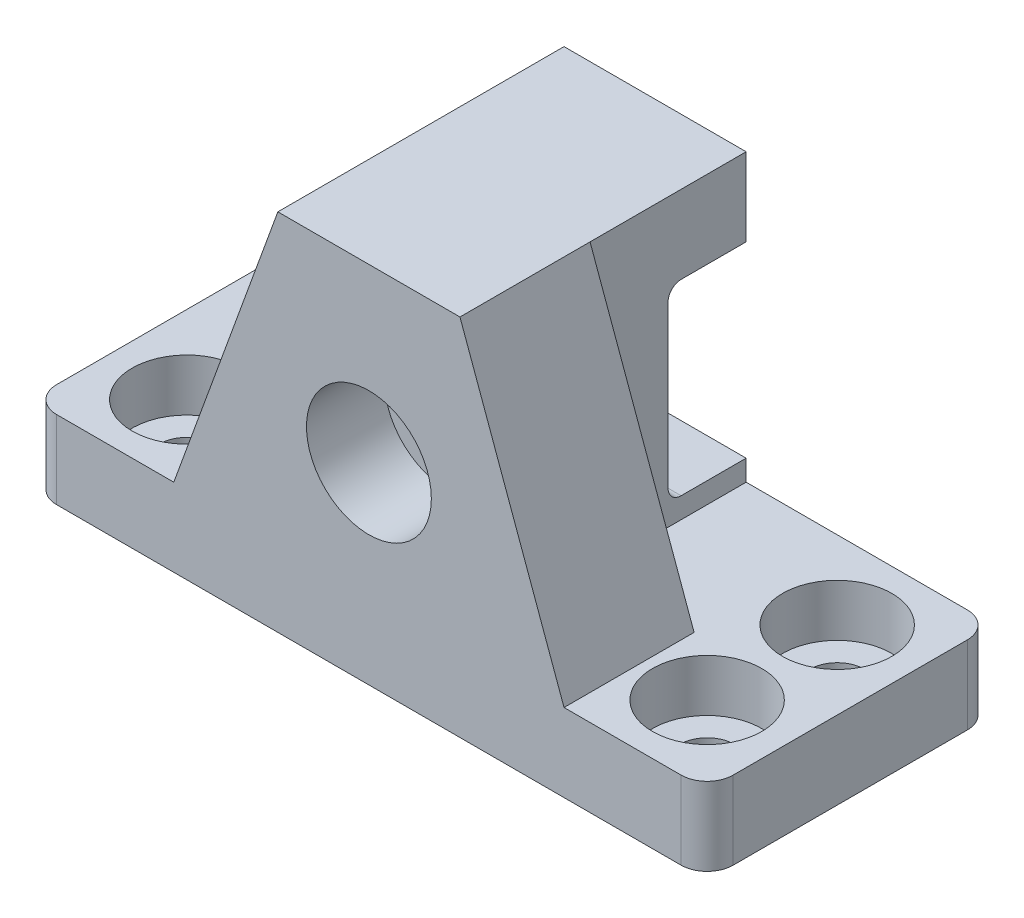
from build123d import *

# Parameters (mm, degrees)
SKETCH1_W           = 26
SKETCH1_H           = 11
SKETCH1_R           = 1.05
BOSS_EXTRUDE1_DEPTH = 3
SKETCH10_R          = 2.1
CUT_EXTRUDE6_DEPTH  = 2
SKETCH3_W           = 7
SKETCH3_H           = 14
BOSS_EXTRUDE2_DEPTH = 11
SKETCH6_W           = 3
SKETCH6_H           = 7.2
CUT_EXTRUDE3_DEPTH  = 23.327113562
SKETCH7_R           = 1.35
CUT_EXTRUDE4_DEPTH  = 21.712315177
SKETCH8_R           = 2.4
CUT_EXTRUDE5_DEPTH  = 3
FILLET1_R           = 0.5
FILLET2_R           = 1
BOSS_EXTRUDE3_DEPTH = 5


with BuildPart() as part:
    # Sketch1 → Boss-Extrude1 (new body)
    with BuildSketch(Plane(origin=(0, 0, 0), x_dir=(1, 0, 0), z_dir=(0, 1, 0))):
        Rectangle(SKETCH1_W, SKETCH1_H)
        with Locations(Location((-10, 2.5, 0), (0, 0, 270))):
            Circle(SKETCH1_R, mode=Mode.SUBTRACT)
        with Locations(Location((-10, -2.5, 0), (0, 0, 270))):
            Circle(SKETCH1_R, mode=Mode.SUBTRACT)
        with Locations(Location((10, 2.5, 0), (0, 0, 270))):
            Circle(SKETCH1_R, mode=Mode.SUBTRACT)
        with Locations(Location((10, -2.5, 0), (0, 0, 270))):
            Circle(SKETCH1_R, mode=Mode.SUBTRACT)
    extrude(amount=BOSS_EXTRUDE1_DEPTH)

    # Sketch10 → Cut-Extrude6 (cut)
    with BuildSketch(Plane(origin=(0, 3, 0), x_dir=(1, 0, 0), z_dir=(0, 1, 0))):
        with Locations(Location((-10, 2.5, 0), (0, 0, 270))):
            Circle(SKETCH10_R)
        with Locations(Location((-10, -2.5, 0), (0, 0, 270))):
            Circle(SKETCH10_R)
        with Locations(Location((10, 2.5, 0), (0, 0, 270))):
            Circle(SKETCH10_R)
        with Locations(Location((10, -2.5, 0), (0, 0, 270))):
            Circle(SKETCH10_R)
    extrude(amount=-CUT_EXTRUDE6_DEPTH, mode=Mode.SUBTRACT)

    # Sketch3 → Boss-Extrude2 (add)
    with BuildSketch(Plane(origin=(0, 0, -5.5), x_dir=(-1, 0, 0), z_dir=(0, 0, -1))):
        with Locations((0, 7)):
            Rectangle(SKETCH3_W, SKETCH3_H)
    extrude(amount=-BOSS_EXTRUDE2_DEPTH)

    # Sketch6 → Cut-Extrude3 (cut, through all)
    with BuildSketch(Plane(origin=(3.5, 0, 0), x_dir=(0, 0, -1), z_dir=(1, 0, 0))):
        with Locations((4, 7.4)):
            Rectangle(SKETCH6_W, SKETCH6_H)
    extrude(amount=-CUT_EXTRUDE3_DEPTH, mode=Mode.SUBTRACT)

    # Sketch7 → Cut-Extrude4 (cut, through all)
    with BuildSketch(Plane(origin=(0, 0, -2.5), x_dir=(-1, 0, 0), z_dir=(0, 0, -1))):
        with Locations(Location((0, 7.4, 0), (0, 0, 90))):
            Circle(SKETCH7_R)
    extrude(amount=-CUT_EXTRUDE4_DEPTH, mode=Mode.SUBTRACT)

    # Sketch8 → Cut-Extrude5 (cut)
    with BuildSketch(Plane.XY.offset(5.5)):
        with Locations((0, 7.4)):
            Circle(SKETCH8_R)
    extrude(amount=-CUT_EXTRUDE5_DEPTH, mode=Mode.SUBTRACT)

    # Fillet1
    fillet1_edges = [part.edges().sort_by_distance(p)[0] for p in [
        (0, 3.8, -2.5),
        (0, 11, -2.5),
    ]]
    fillet(fillet1_edges, radius=FILLET1_R)

    # Fillet2
    fillet2_edges = [part.edges().sort_by_distance(p)[0] for p in [
        (13, 1.5, 5.5),
        (-13, 1.5, 5.5),
        (-13, 1.5, -5.5),
        (13, 1.5, -5.5),
    ]]
    fillet(fillet2_edges, radius=FILLET2_R)

    # Sketch9 → Boss-Extrude3 (add)
    with BuildSketch(Plane.XY.offset(5.5)):
        Polygon((3.5, 3), (3.5, 14), (7.5, 3), align=None)
        Polygon((-7.5, 3), (-3.5, 3), (-3.5, 14), align=None)
    extrude(amount=-BOSS_EXTRUDE3_DEPTH)


solid = part.part
